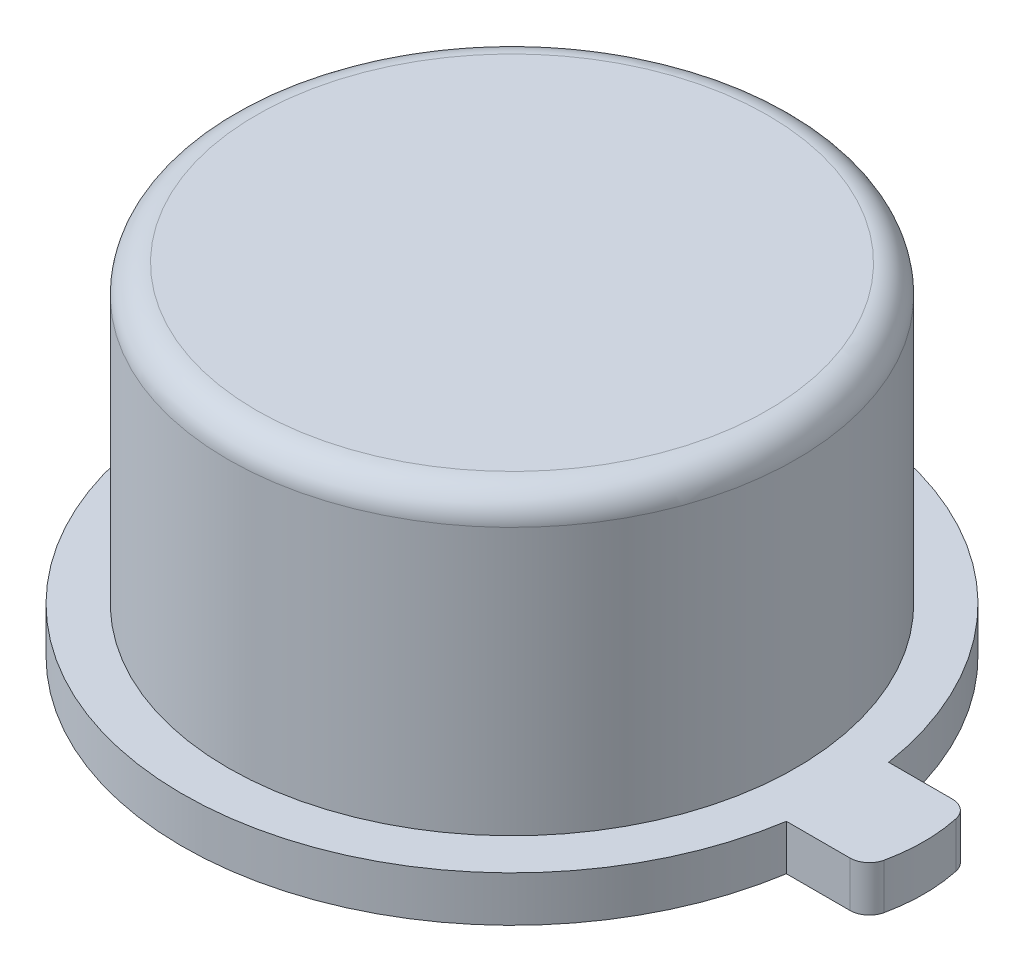
from build123d import *

# Parameters (mm, degrees)
ESQUISSE1_R             = 5
SUPPORT_DEPTH           = 0.8
ESQUISSE2_R             = 5
BOUTON_DEPTH            = 6
CONG_1_R                = 0.5
ESQUISSE3_R             = 3.9
ENL_V_MAT_EXTRU_1_DEPTH = 5
DESSOUS_START           = 4.4
ESQUISSE4_R             = 0.85
DESSOUS_DEPTH           = 4.4


with BuildPart() as part:
    # Esquisse1 → Support (new body)
    with BuildSketch(Plane(origin=(0, 0, 0), x_dir=(1, 0, 0), z_dir=(0, 1, 0))):
        with BuildLine():
            Line((5.72974694, 0.9), (6.85, 0.9))
            ThreePointArc((6.85, 0.9), (7.063933825, 0.824394259), (7.182855864, 0.631154879))
            ThreePointArc((7.182855864, 0.631154879), (7.25, 0), (7.182855864, -0.631154879))
            ThreePointArc((7.182855864, -0.631154879), (7.063933825, -0.824394259), (6.85, -0.9))
            Line((6.85, -0.9), (5.72974694, -0.9))
            ThreePointArc((5.72974694, -0.9), (-5.8, 0), (5.72974694, 0.9))
        make_face()
        with Locations(Location((0, 0, 0), (0, 0, 270))):
            Circle(ESQUISSE1_R, mode=Mode.SUBTRACT)
    extrude(amount=SUPPORT_DEPTH)

    # Esquisse2 → Bouton (add)
    with BuildSketch(Plane(origin=(0, 0, 0), x_dir=(1, 0, 0), z_dir=(0, 1, 0))):
        with Locations(Location((0, 0, 0), (0, 0, 270))):
            Circle(ESQUISSE2_R)
    extrude(amount=BOUTON_DEPTH)

    # Congé1
    cong_1_edges = [part.edges().sort_by_distance(p)[0] for p in [
        (0, 6, -5),
    ]]
    fillet(cong_1_edges, radius=CONG_1_R)

    # Esquisse3 → Enlèv. mat.-Extru.1 (cut)
    with BuildSketch(Plane.XZ):
        with Locations(Location((0, 0, 0), (0, 0, 270))):
            Circle(ESQUISSE3_R)
    extrude(amount=-ENL_V_MAT_EXTRU_1_DEPTH, mode=Mode.SUBTRACT)

    # Esquisse4 → Dessous (add)
    with BuildSketch(Plane.XZ.offset(-5).offset(DESSOUS_START)):
        with BuildLine():
            Line((-0.5, 1.936491673), (-0.5, 3.867815921))
            ThreePointArc((-0.5, 3.867815921), (0, 3.9), (0.5, 3.867815921))
            Line((0.5, 3.867815921), (0.5, 1.936491673))
            ThreePointArc((0.5, 1.936491673), (1.414213562, 1.414213562), (1.936491673, 0.5))
            Line((1.936491673, 0.5), (3.867815921, 0.5))
            ThreePointArc((3.867815921, 0.5), (3.9, 0), (3.867815921, -0.5))
            Line((3.867815921, -0.5), (1.936491673, -0.5))
            ThreePointArc((1.936491673, -0.5), (1.414213562, -1.414213562), (0.5, -1.936491673))
            Line((0.5, -1.936491673), (0.5, -3.867815921))
            ThreePointArc((0.5, -3.867815921), (0, -3.9), (-0.5, -3.867815921))
            Line((-0.5, -3.867815921), (-0.5, -1.936491673))
            ThreePointArc((-0.5, -1.936491673), (-1.414213562, -1.414213562), (-1.936491673, -0.5))
            Line((-1.936491673, -0.5), (-3.867815921, -0.5))
            ThreePointArc((-3.867815921, -0.5), (-3.9, 0), (-3.867815921, 0.5))
            Line((-3.867815921, 0.5), (-1.936491673, 0.5))
            ThreePointArc((-1.936491673, 0.5), (-1.414213562, 1.414213562), (-0.5, 1.936491673))
        make_face()
        with Locations(Location((0, 0, 0), (0, 0, 270))):
            Circle(ESQUISSE4_R, mode=Mode.SUBTRACT)
    extrude(amount=-DESSOUS_DEPTH)


solid = part.part
